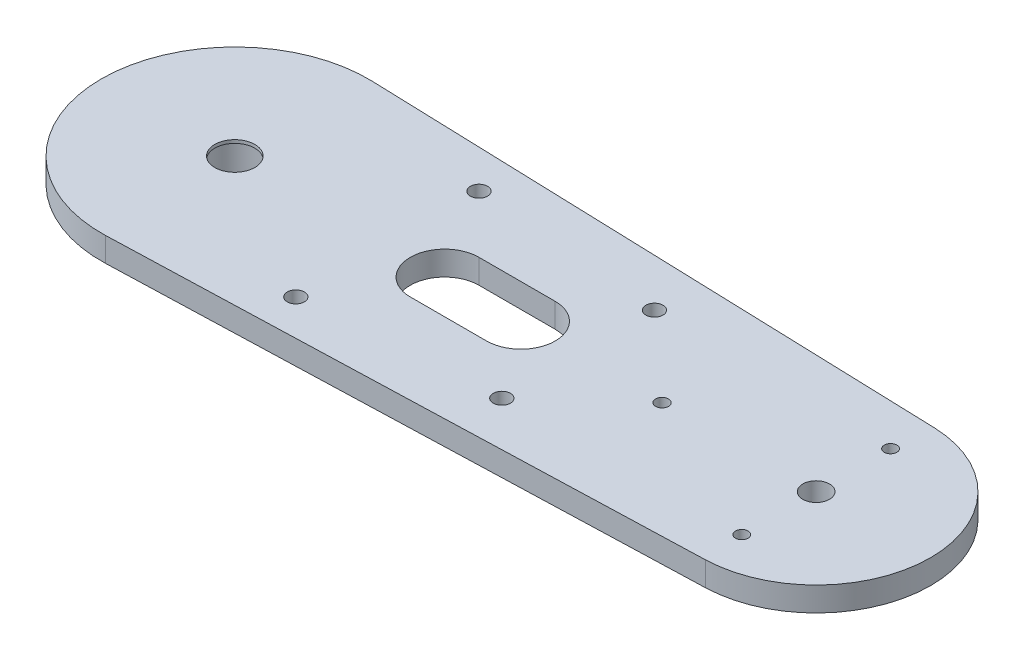
from build123d import *

# Parameters (mm, degrees)
PLACA_START                        = -10.35
PLACA_DEPTH                        = 6.35
PLACA_R1_START                     = -10.35
CROQUIS2_R                         = 35
PLACA_R1_DEPTH                     = 6.35
PLACA_R2_START                     = -10.35
CROQUIS3_R                         = 30
PLACA_R2_DEPTH                     = 6.35
ALIGERADO_START                    = -10.35
ALIGERADO_DEPTH                    = 6.35
BARRENOS_SEPARADORES_M4_START      = -10.35
CROQUIS5_R                         = 2.25
BARRENOS_SEPARADORES_M4_DEPTH      = 6.35
PASO_PIN_Y_ROSCA_M4_EJEFALSO_START = -10.35
CROQUIS6_R                         = 5.25
CROQUIS6_R_2                       = 3.5
CROQUIS6_R_3                       = 1.65
PASO_PIN_Y_ROSCA_M4_EJEFALSO_DEPTH = 6.35
ROSCA_M3_BASES_CINCHO_START        = -10.35
CROQUIS7_R                         = 1.25
ROSCA_M3_BASES_CINCHO_DEPTH        = 6.35
PASO_M3_BASES_CINCHO_START         = -10.35
CROQUIS8_R                         = 1.7
PASO_M3_BASES_CINCHO_DEPTH         = 6.35
CROQUIS9_R                         = 10
SALIENTE_EXTRUIR1_DEPTH            = 4.5
CROQUIS10_R                        = 7.475
CORTAR_EXTRUIR1_DEPTH              = 10


with BuildPart() as part:
    # Croquis1 → Placa (new body)
    with BuildSketch(Plane(origin=(0, 0, 0), x_dir=(1, 0, 0), z_dir=(0, 1, 0)).offset(PLACA_START)):
        Polygon((1.148293963, -206.431158085), (153.384251969, -201.433849787), (153.384251969, -141.466150213), (1.148293963, -136.468841915), align=None)
    extrude(amount=PLACA_DEPTH)

    # Croquis2 → Placa_r1 (add)
    with BuildSketch(Plane(origin=(0, 0, 0), x_dir=(1, 0, 0), z_dir=(0, 1, 0)).offset(PLACA_R1_START)):
        with Locations((0, -171.45)):
            Circle(CROQUIS2_R)
    extrude(amount=PLACA_R1_DEPTH)

    # Croquis3 → Placa_r2 (add)
    with BuildSketch(Plane(origin=(0, 0, 0), x_dir=(1, 0, 0), z_dir=(0, 1, 0)).offset(PLACA_R2_START)):
        with Locations((152.4, -171.45)):
            Circle(CROQUIS3_R)
    extrude(amount=PLACA_R2_DEPTH)

    # Croquis4 → Aligerado (cut)
    with BuildSketch(Plane(origin=(0, 0, 0), x_dir=(1, 0, 0), z_dir=(0, 1, 0)).offset(ALIGERADO_START)):
        with BuildLine():
            Line((55, -162.45), (75, -162.45))
            ThreePointArc((75, -162.45), (84, -171.45), (75, -180.45))
            Line((75, -180.45), (55, -180.45))
            ThreePointArc((55, -180.45), (46, -171.45), (55, -162.45))
        make_face()
    extrude(amount=ALIGERADO_DEPTH, mode=Mode.SUBTRACT)

    # Croquis5 → Barrenos_separadores_M4 (cut)
    with BuildSketch(Plane(origin=(0, 0, 0), x_dir=(1, 0, 0), z_dir=(0, 1, 0)).offset(BARRENOS_SEPARADORES_M4_START)):
        with Locations(Location((40, -195.45, 0), (0, 0, 270))):
            Circle(CROQUIS5_R)
        with Locations(Location((40, -147.45, 0), (0, 0, 270))):
            Circle(CROQUIS5_R)
        with Locations(Location((90, -191.45, 0), (0, 0, 270))):
            Circle(CROQUIS5_R)
        with Locations(Location((90, -151.45, 0), (0, 0, 270))):
            Circle(CROQUIS5_R)
    extrude(amount=BARRENOS_SEPARADORES_M4_DEPTH, mode=Mode.SUBTRACT)

    # Croquis6 → Paso_pin_y_rosca_M4_ejefalso (cut)
    with BuildSketch(Plane(origin=(0, 0, 0), x_dir=(1, 0, 0), z_dir=(0, 1, 0)).offset(PASO_PIN_Y_ROSCA_M4_EJEFALSO_START)):
        with Locations(Location((0, -171.45, 0), (0, 0, 270))):
            Circle(CROQUIS6_R)
        with Locations(Location((152.4, -171.45, 0), (0, 0, 270))):
            Circle(CROQUIS6_R_2)
        with Locations(Location((152.4, -190.95, 0), (0, 0, 270))):
            Circle(CROQUIS6_R_3)
        with Locations(Location((152.4, -151.95, 0), (0, 0, 270))):
            Circle(CROQUIS6_R_3)
    extrude(amount=PASO_PIN_Y_ROSCA_M4_EJEFALSO_DEPTH, mode=Mode.SUBTRACT)

    # Croquis7 → Rosca_M3_bases_cincho (cut)
    with BuildSketch(Plane(origin=(0, 0, 0), x_dir=(1, 0, 0), z_dir=(0, 1, 0)).offset(ROSCA_M3_BASES_CINCHO_START)):
        with Locations(Location((112, -171.45, 0), (0, 0, 270))):
            Circle(CROQUIS7_R)
    extrude(amount=ROSCA_M3_BASES_CINCHO_DEPTH, mode=Mode.SUBTRACT)

    # Croquis8 → Paso_M3_bases_cincho (cut)
    with BuildSketch(Plane(origin=(0, 0, 0), x_dir=(1, 0, 0), z_dir=(0, 1, 0)).offset(PASO_M3_BASES_CINCHO_START)):
        with Locations(Location((112, -171.45, 0), (0, 0, 270))):
            Circle(CROQUIS8_R)
    extrude(amount=PASO_M3_BASES_CINCHO_DEPTH, mode=Mode.SUBTRACT)

    # Croquis9 → Saliente-Extruir1 (add)
    with BuildSketch(Plane.XZ.offset(10.35)):
        with Locations(Location((0, 171.45, 0), (0, 0, 270))):
            Circle(CROQUIS9_R)
    extrude(amount=SALIENTE_EXTRUIR1_DEPTH)

    # Croquis10 → Cortar-Extruir1 (cut)
    with BuildSketch(Plane.XZ.offset(14.85)):
        with Locations(Location((0, 171.45, 0), (0, 0, 270))):
            Circle(CROQUIS10_R)
    extrude(amount=-CORTAR_EXTRUIR1_DEPTH, mode=Mode.SUBTRACT)


solid = part.part
